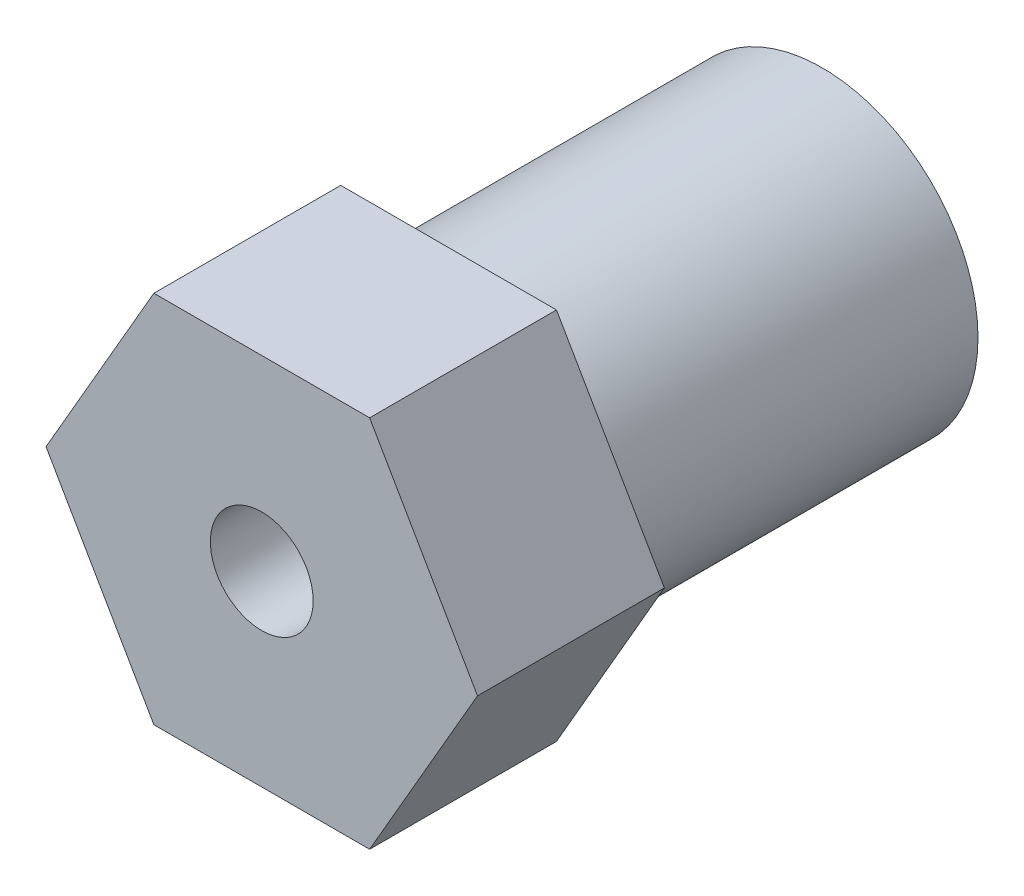
from build123d import *

# Parameters (mm, degrees)
BOSS_EXTRUDE1_DEPTH = 6
SKETCH2_R           = 5
BOSS_EXTRUDE2_DEPTH = 12
SKETCH3_R           = 2.5
CUT_EXTRUDE1_DEPTH  = 12
SKETCH4_R           = 1.65
CUT_EXTRUDE2_DEPTH  = 6
SKETCH5_R           = 1.25
CUT_EXTRUDE3_DEPTH  = 5.1


with BuildPart() as part:
    # Sketch1 → Boss-Extrude1 (new body)
    with BuildSketch(Plane.XY):
        Polygon((6.92820323, 0), (3.464101615, 6), (-3.464101615, 6), (-6.92820323, 0), (-3.464101615, -6), (3.464101615, -6), align=None)
    extrude(amount=BOSS_EXTRUDE1_DEPTH)

    # Sketch2 → Boss-Extrude2 (add)
    with BuildSketch(Plane.XY):
        Circle(SKETCH2_R)
    extrude(amount=-BOSS_EXTRUDE2_DEPTH)

    # Sketch3 → Cut-Extrude1 (cut)
    with BuildSketch(Plane.XY):
        Circle(SKETCH3_R)
    extrude(amount=-CUT_EXTRUDE1_DEPTH, mode=Mode.SUBTRACT)

    # Sketch4 → Cut-Extrude2 (cut)
    with BuildSketch(Plane.XY):
        Circle(SKETCH4_R)
    extrude(amount=CUT_EXTRUDE2_DEPTH, mode=Mode.SUBTRACT)

    # Sketch5 → Cut-Extrude3 (cut)
    with BuildSketch(Plane(origin=(0, 0, 0), x_dir=(1, 0, 0), z_dir=(0, 1, 0))):
        with Locations(Location((0, 9, 0), (0, 0, 270))):
            Circle(SKETCH5_R)
    extrude(amount=-CUT_EXTRUDE3_DEPTH, mode=Mode.SUBTRACT)


solid = part.part
